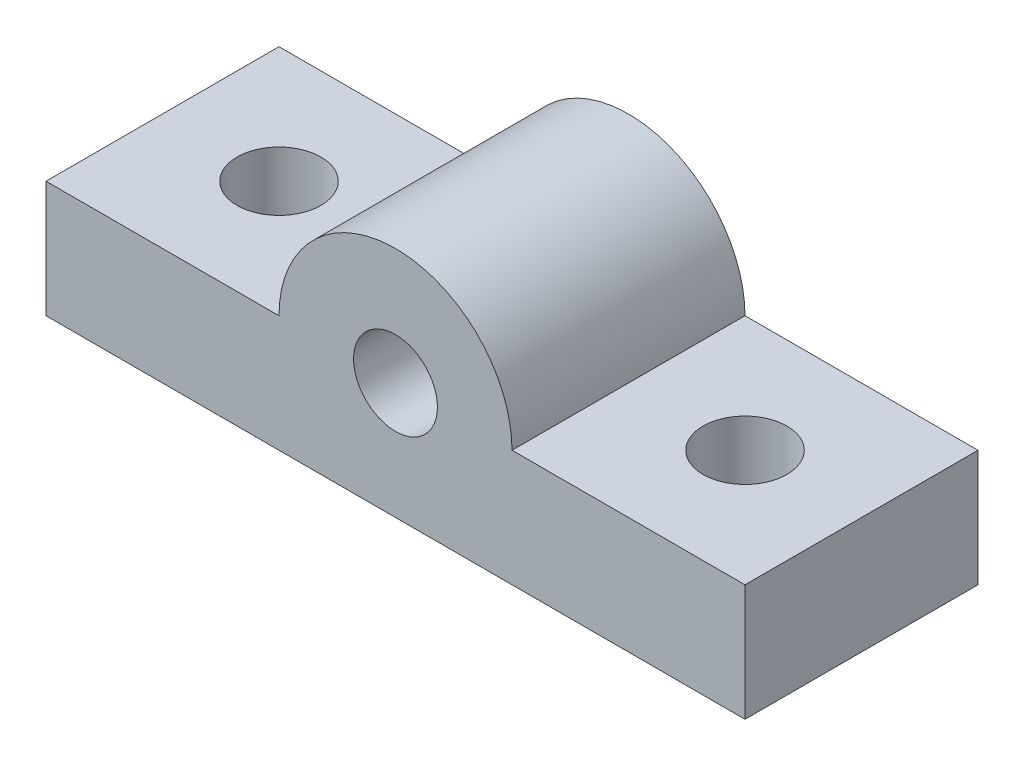
from build123d import *

# Parameters (mm, degrees)
SKETCH1_W           = 38.1
SKETCH1_H           = 12.7
SKETCH1_R           = 2.286
BOSS_EXTRUDE1_DEPTH = 6.35
SKETCH4_R           = 6.35
BOSS_EXTRUDE2_DEPTH = 12.7
SKETCH2_R           = 2.286
CUT_EXTRUDE1_DEPTH  = 27.181720723


with BuildPart() as part:
    # Sketch1 → Boss-Extrude1 (new body)
    with BuildSketch(Plane(origin=(0, 0, 0), x_dir=(1, 0, 0), z_dir=(0, 1, 0))):
        Rectangle(SKETCH1_W, SKETCH1_H)
        with Locations(Location((-12.7, 0, 0), (0, 0, 270))):
            Circle(SKETCH1_R, mode=Mode.SUBTRACT)
        with Locations(Location((12.7, 0, 0), (0, 0, 270))):
            Circle(SKETCH1_R, mode=Mode.SUBTRACT)
    extrude(amount=BOSS_EXTRUDE1_DEPTH)

    # Sketch4 → Boss-Extrude2 (add)
    with BuildSketch(Plane.XY.offset(6.35)):
        with Locations((0, 6.35)):
            Circle(SKETCH4_R)
    extrude(amount=-BOSS_EXTRUDE2_DEPTH)

    # Sketch2 → Cut-Extrude1 (cut, through all)
    with BuildSketch(Plane.XY.offset(6.35)):
        with Locations((0, 6.35)):
            Circle(SKETCH2_R)
    extrude(amount=-CUT_EXTRUDE1_DEPTH, mode=Mode.SUBTRACT)


solid = part.part
